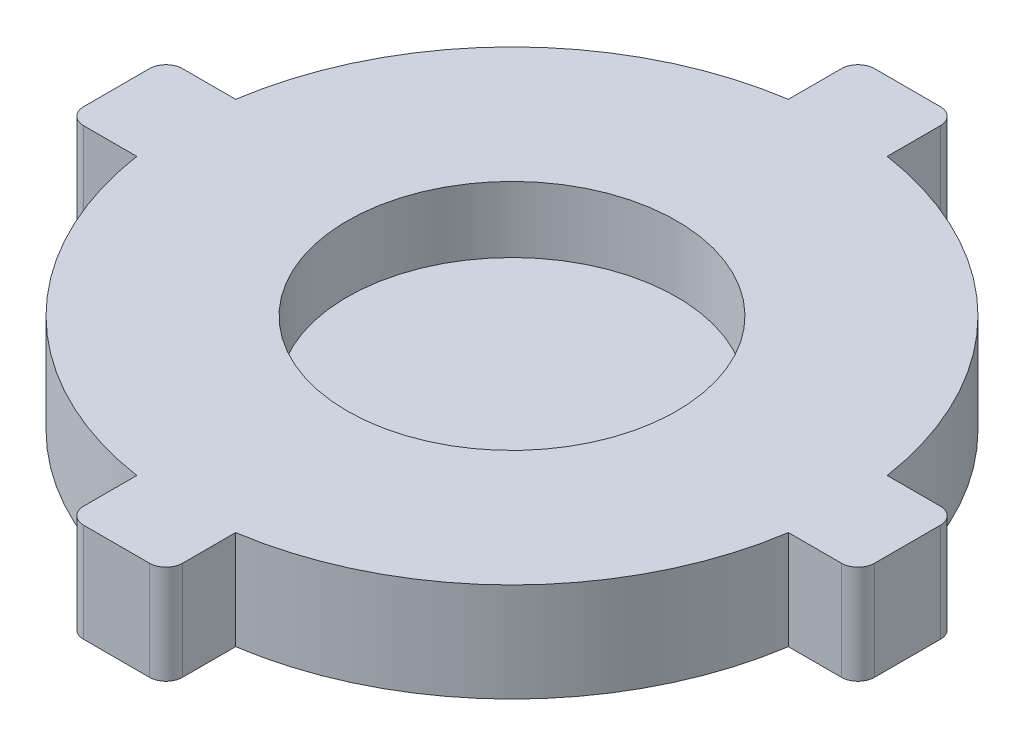
from build123d import *
from build123d.topology import SkipClean

# Parameters (mm, degrees)
SKETCH1_R           = 100
SKETCH1_R_2         = 50
BOSS_EXTRUDE3_DEPTH = 30
BOSS_EXTRUDE4_DEPTH = 10


with BuildPart() as part:
    # Sketch1 → Boss-Extrude3 (new body)
    # profile 1 of 16: a face of its own
    with SkipClean():  # the faces are left unmerged after this step: merging them gives an invalid solid
        with BuildSketch(Plane(origin=(0, 0, 0), x_dir=(1, 0, 0), z_dir=(0, 1, 0))):
            Circle(SKETCH1_R)
            with Locations(Location((0, 0, 0), (0, 0, 270))):
                Circle(SKETCH1_R_2, mode=Mode.SUBTRACT)
        # profile 2 of 16: a face of its own
        with BuildSketch(Plane(origin=(0, 0, 0), x_dir=(1, 0, 0), z_dir=(0, 1, 0))):
            with BuildLine():
                ThreePointArc((-15, 52.915026221), (0, 55), (15, 52.915026221))
                Line((15, 52.915026221), (15, 98.868599666))
                ThreePointArc((15, 98.868599666), (0, 100), (-15, 98.868599666))
                Line((-15, 98.868599666), (-15, 52.915026221))
            make_face()
        # profile 3 of 16: a face of its own
        with BuildSketch(Plane(origin=(0, 0, 0), x_dir=(1, 0, 0), z_dir=(0, 1, 0))):
            with BuildLine():
                ThreePointArc((-15, 47.696960071), (-7.587884964, 49.420886291), (0, 50))
                ThreePointArc((0, 50), (7.587884964, 49.420886291), (15, 47.696960071))
                Line((15, 47.696960071), (15, 52.915026221))
                ThreePointArc((15, 52.915026221), (0, 55), (-15, 52.915026221))
                Line((-15, 52.915026221), (-15, 47.696960071))
            make_face()
        # profile 4 of 16: a face of its own
        with BuildSketch(Plane(origin=(0, 0, 0), x_dir=(1, 0, 0), z_dir=(0, 1, 0))):
            with BuildLine():
                ThreePointArc((-15, 98.868599666), (0, 100), (15, 98.868599666))
                Line((15, 98.868599666), (15, 115))
                ThreePointArc((15, 115), (13.535533906, 118.535533906), (10, 120))
                Line((10, 120), (-10, 120))
                ThreePointArc((-10, 120), (-13.535533906, 118.535533906), (-15, 115))
                Line((-15, 115), (-15, 98.868599666))
            make_face()
        # profile 5 of 16: a face of its own
        with BuildSketch(Plane(origin=(0, 0, 0), x_dir=(1, 0, 0), z_dir=(0, 1, 0))):
            with BuildLine():
                ThreePointArc((-98.868599666, -15), (-100, 0), (-98.868599666, 15))
                Line((-98.868599666, 15), (-115, 15))
                ThreePointArc((-115, 15), (-118.535533906, 13.535533906), (-120, 10))
                Line((-120, 10), (-120, -10))
                ThreePointArc((-120, -10), (-118.535533906, -13.535533906), (-115, -15))
                Line((-115, -15), (-98.868599666, -15))
            make_face()
        # profile 6 of 16: a face of its own
        with BuildSketch(Plane(origin=(0, 0, 0), x_dir=(1, 0, 0), z_dir=(0, 1, 0))):
            with BuildLine():
                ThreePointArc((-52.915026221, -15), (-55, 0), (-52.915026221, 15))
                Line((-52.915026221, 15), (-98.868599666, 15))
                ThreePointArc((-98.868599666, 15), (-100, 0), (-98.868599666, -15))
                Line((-98.868599666, -15), (-52.915026221, -15))
            make_face()
        # profile 7 of 16: a face of its own
        with BuildSketch(Plane(origin=(0, 0, 0), x_dir=(1, 0, 0), z_dir=(0, 1, 0))):
            with BuildLine():
                ThreePointArc((-47.696960071, 15), (-35.355339059, 35.355339059), (-15, 47.696960071))
                Line((-15, 47.696960071), (-15, 52.915026221))
                Line((-15, 52.915026221), (-15, 98.868599666))
                ThreePointArc((-15, 98.868599666), (-70.710678119, 70.710678119), (-98.868599666, 15))
                Line((-98.868599666, 15), (-52.915026221, 15))
                Line((-52.915026221, 15), (-47.696960071, 15))
            make_face()
        # profile 8 of 16: a face of its own
        with BuildSketch(Plane(origin=(0, 0, 0), x_dir=(1, 0, 0), z_dir=(0, 1, 0))):
            with BuildLine():
                Line((-15, -52.915026221), (-15, -47.696960071))
                ThreePointArc((-15, -47.696960071), (-35.355339059, -35.355339059), (-47.696960071, -15))
                Line((-47.696960071, -15), (-52.915026221, -15))
                Line((-52.915026221, -15), (-98.868599666, -15))
                ThreePointArc((-98.868599666, -15), (-70.710678119, -70.710678119), (-15, -98.868599666))
                Line((-15, -98.868599666), (-15, -52.915026221))
            make_face()
        # profile 9 of 16: a face of its own
        with BuildSketch(Plane(origin=(0, 0, 0), x_dir=(1, 0, 0), z_dir=(0, 1, 0))):
            with BuildLine():
                ThreePointArc((15, -52.915026221), (0, -55), (-15, -52.915026221))
                Line((-15, -52.915026221), (-15, -98.868599666))
                ThreePointArc((-15, -98.868599666), (0, -100), (15, -98.868599666))
                Line((15, -98.868599666), (15, -52.915026221))
            make_face()
        # profile 10 of 16: a face of its own
        with BuildSketch(Plane(origin=(0, 0, 0), x_dir=(1, 0, 0), z_dir=(0, 1, 0))):
            with BuildLine():
                ThreePointArc((15, -98.868599666), (0, -100), (-15, -98.868599666))
                Line((-15, -98.868599666), (-15, -115))
                ThreePointArc((-15, -115), (-13.535533906, -118.535533906), (-10, -120))
                Line((-10, -120), (10, -120))
                ThreePointArc((10, -120), (13.535533906, -118.535533906), (15, -115))
                Line((15, -115), (15, -98.868599666))
            make_face()
        # profile 11 of 16: a face of its own
        with BuildSketch(Plane(origin=(0, 0, 0), x_dir=(1, 0, 0), z_dir=(0, 1, 0))):
            with BuildLine():
                ThreePointArc((47.696960071, -15), (35.355339059, -35.355339059), (15, -47.696960071))
                Line((15, -47.696960071), (15, -52.915026221))
                Line((15, -52.915026221), (15, -98.868599666))
                ThreePointArc((15, -98.868599666), (70.710678119, -70.710678119), (98.868599666, -15))
                Line((98.868599666, -15), (52.915026221, -15))
                Line((52.915026221, -15), (47.696960071, -15))
            make_face()
        # profile 12 of 16: a face of its own
        with BuildSketch(Plane(origin=(0, 0, 0), x_dir=(1, 0, 0), z_dir=(0, 1, 0))):
            with BuildLine():
                Line((98.868599666, 15), (52.915026221, 15))
                ThreePointArc((52.915026221, 15), (55, 0), (52.915026221, -15))
                Line((52.915026221, -15), (98.868599666, -15))
                ThreePointArc((98.868599666, -15), (99.71674876, -7.521304187), (100, 0))
                ThreePointArc((100, 0), (99.71674876, 7.521304187), (98.868599666, 15))
            make_face()
        # profile 13 of 16: a face of its own
        with BuildSketch(Plane(origin=(0, 0, 0), x_dir=(1, 0, 0), z_dir=(0, 1, 0))):
            with BuildLine():
                Line((115, 15), (98.868599666, 15))
                ThreePointArc((98.868599666, 15), (99.71674876, 7.521304187), (100, 0))
                ThreePointArc((100, 0), (99.71674876, -7.521304187), (98.868599666, -15))
                Line((98.868599666, -15), (115, -15))
                ThreePointArc((115, -15), (118.535533906, -13.535533906), (120, -10))
                Line((120, -10), (120, 10))
                ThreePointArc((120, 10), (118.535533906, 13.535533906), (115, 15))
            make_face()
        # profile 14 of 16: a face of its own
        with BuildSketch(Plane(origin=(0, 0, 0), x_dir=(1, 0, 0), z_dir=(0, 1, 0))):
            with BuildLine():
                Line((15, 52.915026221), (15, 47.696960071))
                ThreePointArc((15, 47.696960071), (35.355339059, 35.355339059), (47.696960071, 15))
                Line((47.696960071, 15), (52.915026221, 15))
                Line((52.915026221, 15), (98.868599666, 15))
                ThreePointArc((98.868599666, 15), (70.710678119, 70.710678119), (15, 98.868599666))
                Line((15, 98.868599666), (15, 52.915026221))
            make_face()
        # profile 15 of 16: a face of its own
        with BuildSketch(Plane(origin=(0, 0, 0), x_dir=(1, 0, 0), z_dir=(0, 1, 0))):
            with BuildLine():
                ThreePointArc((15, -47.696960071), (7.587884964, -49.420886291), (0, -50))
                ThreePointArc((0, -50), (-7.587884964, -49.420886291), (-15, -47.696960071))
                Line((-15, -47.696960071), (-15, -52.915026221))
                ThreePointArc((-15, -52.915026221), (0, -55), (15, -52.915026221))
                Line((15, -52.915026221), (15, -47.696960071))
            make_face()
        # profile 16 of 16: a face of its own
        with BuildSketch(Plane(origin=(0, 0, 0), x_dir=(1, 0, 0), z_dir=(0, 1, 0))):
            with BuildLine():
                Line((52.915026221, 15), (47.696960071, 15))
                ThreePointArc((47.696960071, 15), (49.420886291, 7.587884964), (50, 0))
                ThreePointArc((50, 0), (49.420886291, -7.587884964), (47.696960071, -15))
                Line((47.696960071, -15), (52.915026221, -15))
                ThreePointArc((52.915026221, -15), (55, 0), (52.915026221, 15))
            make_face()
        extrude(amount=BOSS_EXTRUDE3_DEPTH)

    # Sketch1<7> → Boss-Extrude4 (add)
    with SkipClean():  # the faces are left unmerged after this step: merging them gives an invalid solid
        with BuildSketch(Plane(origin=(0, 0, 0), x_dir=(1, 0, 0), z_dir=(0, 1, 0))):
            with BuildLine():
                ThreePointArc((15, 47.696960071), (7.587884964, 49.420886291), (0, 50))
                Line((0, 50), (0, -50))
                ThreePointArc((0, -50), (7.587884964, -49.420886291), (15, -47.696960071))
                ThreePointArc((15, -47.696960071), (35.355339059, -35.355339059), (47.696960071, -15))
                ThreePointArc((47.696960071, -15), (49.420886291, -7.587884964), (50, 0))
                ThreePointArc((50, 0), (49.420886291, 7.587884964), (47.696960071, 15))
                ThreePointArc((47.696960071, 15), (35.355339059, 35.355339059), (15, 47.696960071))
            make_face()
            with BuildLine():
                Line((0, -50), (0, 50))
                ThreePointArc((0, 50), (-7.587884964, 49.420886291), (-15, 47.696960071))
                ThreePointArc((-15, 47.696960071), (-35.355339059, 35.355339059), (-47.696960071, 15))
                ThreePointArc((-47.696960071, 15), (-50, 0), (-47.696960071, -15))
                ThreePointArc((-47.696960071, -15), (-35.355339059, -35.355339059), (-15, -47.696960071))
                ThreePointArc((-15, -47.696960071), (-7.587884964, -49.420886291), (0, -50))
            make_face()
        extrude(amount=BOSS_EXTRUDE4_DEPTH)


solid = part.part
